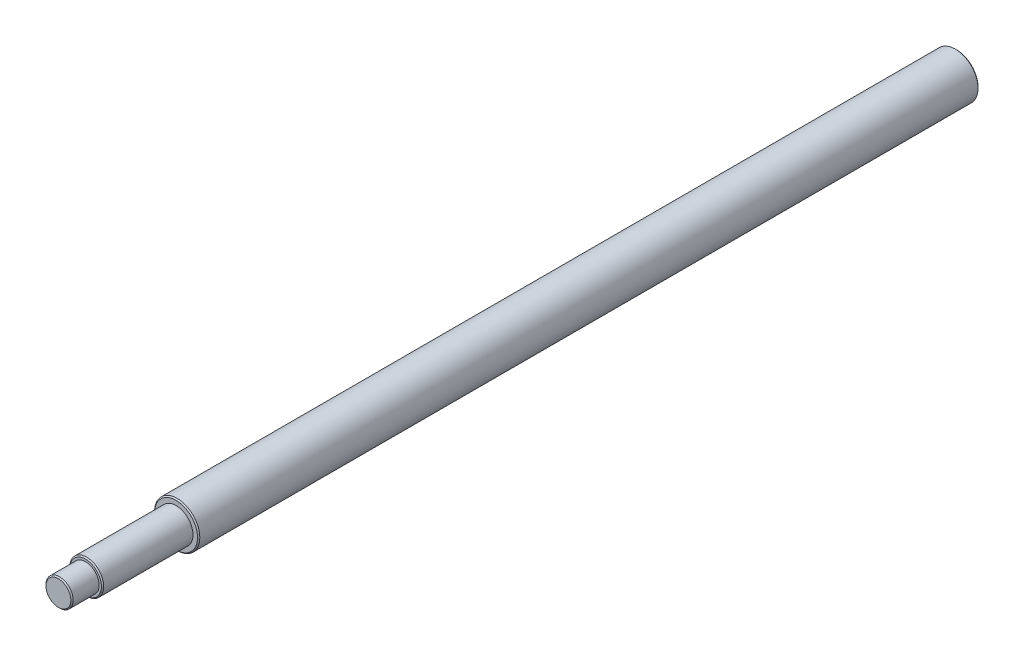
from build123d import *

# Parameters (mm, degrees)
SKETCH1_R           = 10
BOSS_EXTRUDE1_DEPTH = 172.5
SKETCH4_R           = 7.5
BOSS_EXTRUDE2_DEPTH = 40
SKETCH5_R           = 6
BOSS_EXTRUDE3_DEPTH = 12
CHAMFER1_SIZE       = 0.5


with BuildPart() as part:
    # Sketch1 → Boss-Extrude1 (new, symmetric)
    with BuildSketch(Plane.XY):
        Circle(SKETCH1_R)
    extrude(amount=BOSS_EXTRUDE1_DEPTH, both=True)

    # Sketch4 → Boss-Extrude2 (add)
    with BuildSketch(Plane.XY.offset(172.5)):
        Circle(SKETCH4_R)
    extrude(amount=BOSS_EXTRUDE2_DEPTH)

    # Sketch5 → Boss-Extrude3 (add)
    with BuildSketch(Plane.XY.offset(212.5)):
        Circle(SKETCH5_R)
    extrude(amount=BOSS_EXTRUDE3_DEPTH)

    # Chamfer1
    chamfer1_edges = [part.edges().sort_by_distance(p)[0] for p in [
        (-6, 0, 224.5),
        (-10, 0, -172.5),
        (-10, 0, 172.5),
        (-7.5, 0, 212.5),
    ]]
    chamfer(chamfer1_edges, length=CHAMFER1_SIZE)


solid = part.part
